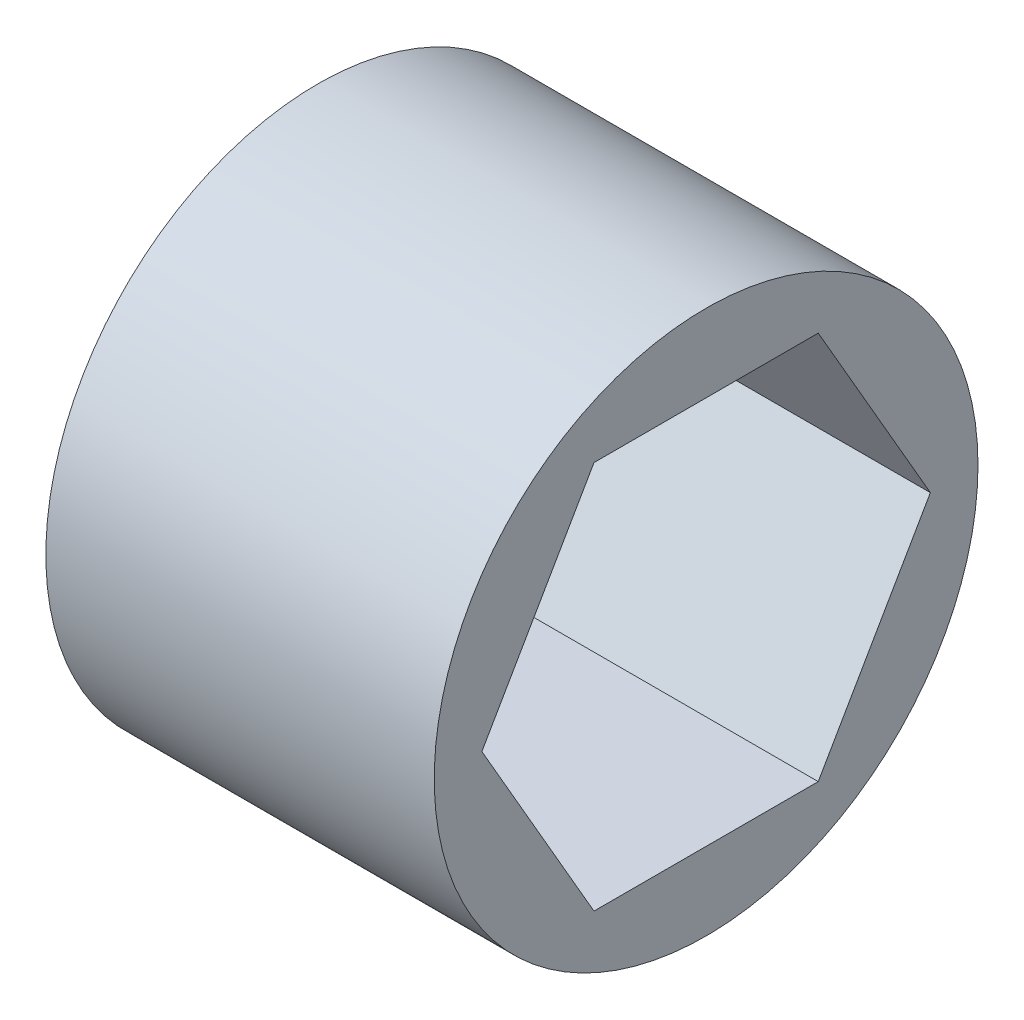
from build123d import *

# Parameters (mm, degrees)
SKETCH4_R           = 8.89
BOSS_EXTRUDE3_DEPTH = 12.7


with BuildPart() as part:
    # Sketch4 → Boss-Extrude3 (new body)
    with BuildSketch(Plane(origin=(0, 0, 0), x_dir=(0, 0, -1), z_dir=(1, 0, 0))):
        Circle(SKETCH4_R)
        Polygon((3.666174209, 6.35), (-3.666174209, 6.35), (-7.332348419, 0), (-3.666174209, -6.35), (3.666174209, -6.35), (7.332348419, 0), align=None, mode=Mode.SUBTRACT)
    extrude(amount=BOSS_EXTRUDE3_DEPTH)


solid = part.part
